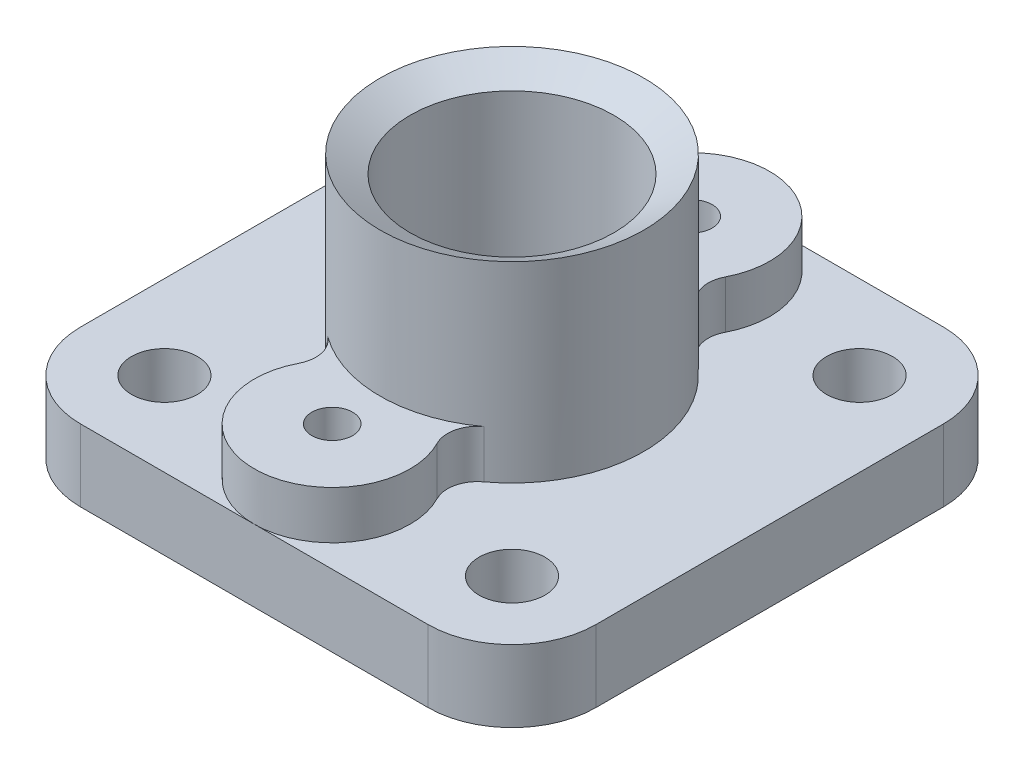
from build123d import *

# Parameters (mm, degrees)
EXTRUDE_1_DEPTH          = 12
CUT_EXTRUDE_1_DEPTH      = 62.983868869
CUT_EXTRUDE_1_DEPTH_BACK = 62.983868869
SKETCH_4_R               = 5.5
SKETCH_5_R               = 22
EXTRUDE_2_DEPTH          = 32
SKETCH_6_R               = 13
EXTRUDE_3_DEPTH          = 8
SKETCH_7_R               = 21
EXTRUDE_4_DEPTH          = 7
EXTRUDE_5_DEPTH          = 7
CHAMFER_1_SIZE           = 1
HOLE_WIZARD_M8_1_D       = 6.8
HOLE_WIZARD_M8_1_DEPTH   = 18
HOLE_WIZARD_M8_1_TIP     = 2.042926105
FILLET_1_R               = 5


with BuildPart() as part:
    # 草图2 → 凸台-拉伸1 (new body)
    with BuildSketch(Plane(origin=(0, 0, 0), x_dir=(1, 0, 0), z_dir=(0, 1, 0))):
        with BuildLine():
            Line((-29, 43), (29, 43))
            ThreePointArc((29, 43), (38.899494937, 38.899494937), (43, 29))
            Line((43, 29), (43, -29))
            ThreePointArc((43, -29), (38.899494937, -38.899494937), (29, -43))
            Line((29, -43), (-29, -43))
            ThreePointArc((-29, -43), (-38.899494937, -38.899494937), (-43, -29))
            Line((-43, -29), (-43, 29))
            ThreePointArc((-43, 29), (-38.899494937, 38.899494937), (-29, 43))
        make_face()
    extrude(amount=EXTRUDE_1_DEPTH)

    # 草图4 → 切除-拉伸1 (cut, two sides: drawn at the far end of the back side and taken through both)
    with BuildSketch(Plane(origin=(0, 12, 0), x_dir=(1, 0, 0), z_dir=(0, 1, 0)).offset(-CUT_EXTRUDE_1_DEPTH_BACK)):
        with Locations(Location((29, 29, 0), (0, 0, 270))):
            Circle(SKETCH_4_R)
        with Locations(Location((29, -29, 0), (0, 0, 270))):
            Circle(SKETCH_4_R)
        with Locations(Location((-29, -29, 0), (0, 0, 270))):
            Circle(SKETCH_4_R)
        with Locations(Location((-29, 29, 0), (0, 0, 270))):
            Circle(SKETCH_4_R)
    extrude(amount=CUT_EXTRUDE_1_DEPTH + CUT_EXTRUDE_1_DEPTH_BACK, mode=Mode.SUBTRACT)

    # 草图5 → 凸台-拉伸2 (add)
    with BuildSketch(Plane(origin=(0, 12, 0), x_dir=(1, 0, 0), z_dir=(0, 1, 0))):
        with Locations(Location((0, 0, 0), (0, 0, 90))):
            Circle(SKETCH_5_R)
    extrude(amount=EXTRUDE_2_DEPTH)

    # 草图6 → 凸台-拉伸3 (add)
    with BuildSketch(Plane(origin=(0, 12, 0), x_dir=(1, 0, 0), z_dir=(0, 1, 0))):
        with Locations((0, 30)):
            Circle(SKETCH_6_R)
        with Locations((0, -30)):
            Circle(SKETCH_6_R)
    extrude(amount=EXTRUDE_3_DEPTH)

    # 草图7 → 凸台-拉伸4 (add)
    with BuildSketch(Plane.XZ):
        with Locations(Location((0, 0, 0), (0, 0, 270))):
            Circle(SKETCH_7_R)
    extrude(amount=EXTRUDE_4_DEPTH)

    # 草图8 → 凸台-拉伸5 (add)
    with BuildSketch(Plane.XZ.offset(7)):
        with BuildLine():
            Line((21, 0), (15, 0))
            ThreePointArc((15, 0), (3.882285677, -14.488887394), (-12.990381057, -7.5))
            Line((-12.990381057, -7.5), (-18.186533479, -10.5))
            ThreePointArc((-18.186533479, -10.5), (5.435199947, -20.284442352), (21, 0))
        make_face()
    extrude(amount=EXTRUDE_5_DEPTH)

    # 倒角1
    chamfer_1_edges = [part.edges().sort_by_distance(p)[0] for p in [
        (3.882285677, -14, -14.488887394),
    ]]
    chamfer(chamfer_1_edges, length=CHAMFER_1_SIZE)

    # 草图9 → 切除-旋转1 (revolve, cut)
    with BuildSketch(Plane.XY, mode=Mode.PRIVATE) as cut_revolve_1_sk:
        Polygon((22, 44), (17, 41.113248654), (17, 17), (12, 14.113248654), (12, -7), (0, -7), (0, 44), align=None)
    revolve(cut_revolve_1_sk.sketch.rotate(Axis((0, 44, 0), (0, -1, 0)), 90), axis=Axis((0, 44, 0), (0, -1, 0)), mode=Mode.SUBTRACT)

    # M8 螺纹孔1
    with Locations(Plane(origin=(0, 20, -30), x_dir=(0, 0, 1), z_dir=(0, 1, 0))):
        with Locations((0, 0), (60, 0)):
            Hole(HOLE_WIZARD_M8_1_D / 2, depth=HOLE_WIZARD_M8_1_DEPTH)
            with Locations((0, 0, -(HOLE_WIZARD_M8_1_DEPTH + HOLE_WIZARD_M8_1_TIP / 2))):  # 118° drill point
                Cone(0, HOLE_WIZARD_M8_1_D / 2, HOLE_WIZARD_M8_1_TIP, mode=Mode.SUBTRACT)

    # 圆角1
    fillet_1_edges = [part.edges().sort_by_distance(p)[0] for p in [
        (-8.598691761, 16, -20.25),
        (8.598691761, 16, -20.25),
        (-8.598691761, 16, 20.25),
        (8.598691761, 16, 20.25),
    ]]
    fillet(fillet_1_edges, radius=FILLET_1_R)


solid = part.part
